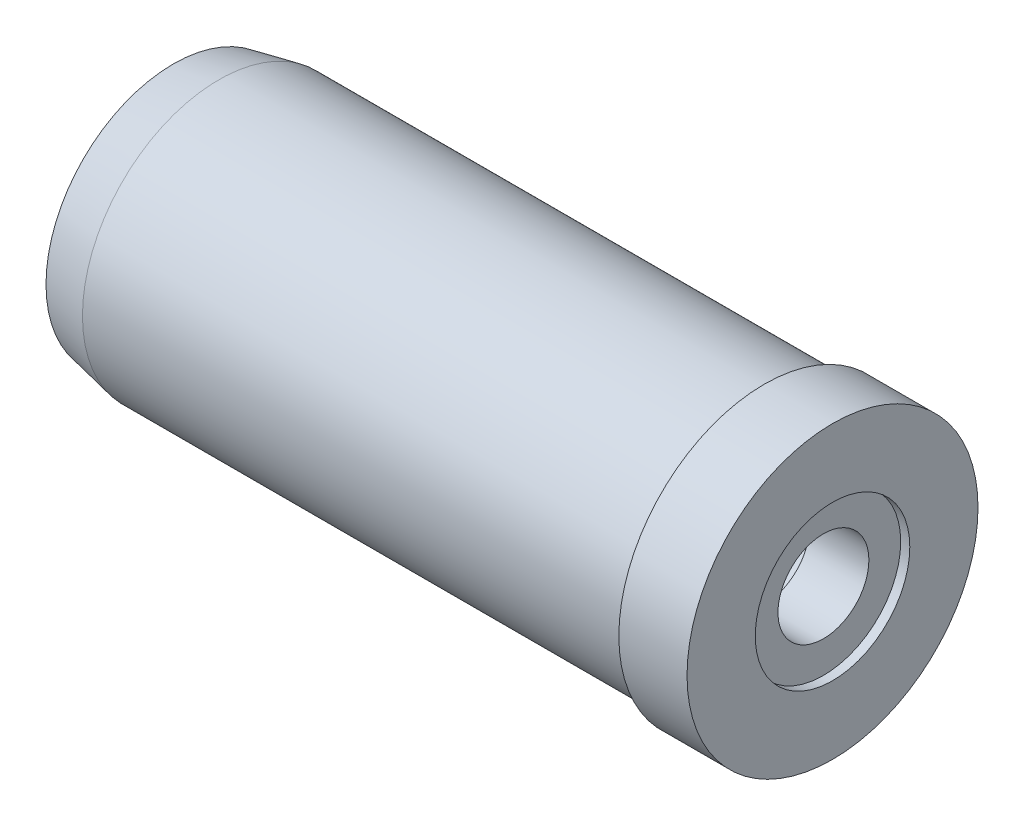
from build123d import *


with BuildPart() as part:
    # Esquisse1 → Révolution1 (revolve)
    with BuildSketch(Plane.XY, mode=Mode.PRIVATE) as r_volution1_sk:
        Polygon((175.54977417, 10), (175.54977417, 17), (177.54977417, 17), (177.54977417, 32), (162.54977417, 32), (162.54977417, 30), (42.566441994, 30), (32.54977417, 28), (32.54977417, 24), (162.54977417, 24), (162.54977417, 10), align=None)
    revolve(r_volution1_sk.sketch.rotate(Axis((32.54977417, 0, 0), (1, 0, 0)), 270), axis=Axis((32.54977417, 0, 0), (1, 0, 0)))


solid = part.part
